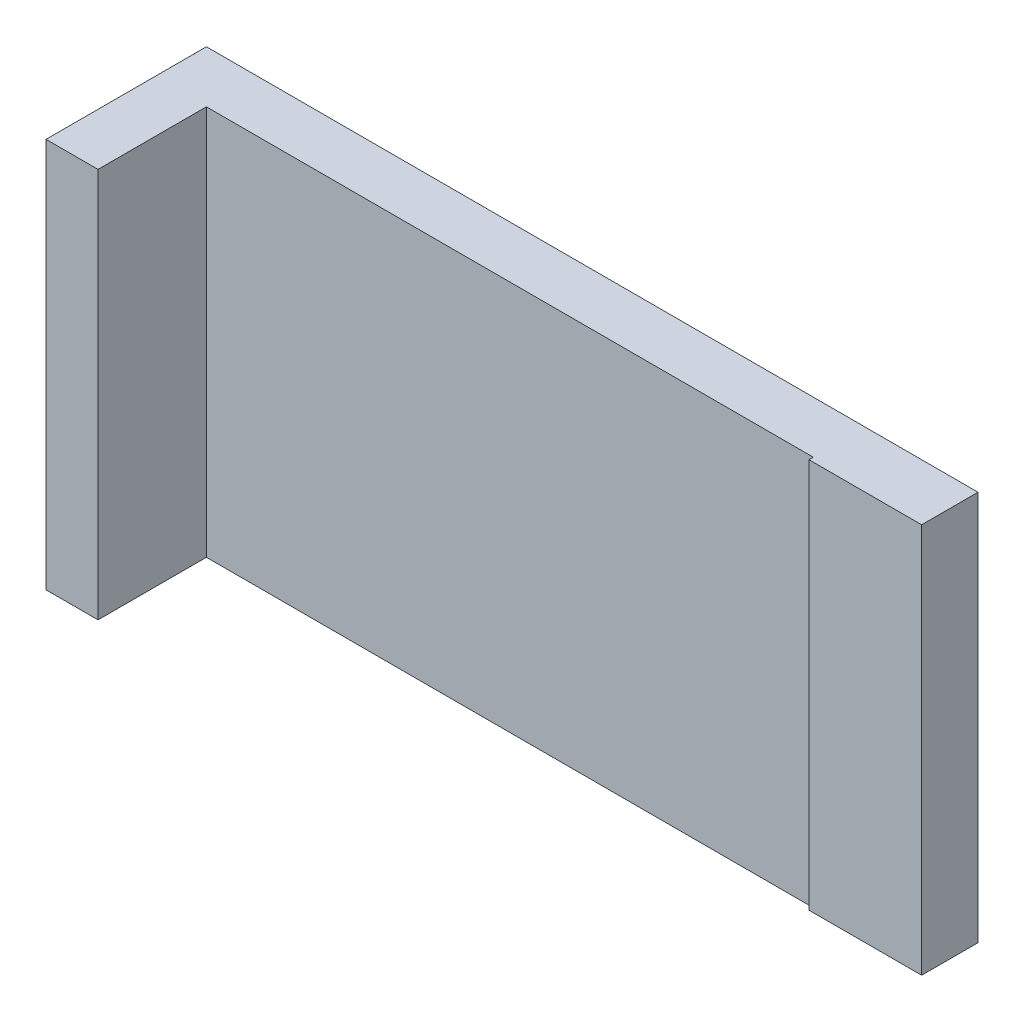
from build123d import *

# Parameters (mm, degrees)
ESBO_O1_W                = 41.5
ESBO_O1_H                = 22.5
RESSALTO_EXTRUS_O1_DEPTH = 3
ESBO_O2_W                = 9.25
ESBO_O2_H                = 22.5
RESSALTO_EXTRUS_O2_DEPTH = 3
ESBO_O3_W                = 6.5
ESBO_O3_H                = 22.5
RESSALTO_EXTRUS_O3_DEPTH = 3.25


with BuildPart() as part:
    # Esboço1 → Ressalto-extrusão1 (new body)
    with BuildSketch(Plane.XY):
        with Locations((4.5, 0)):
            Rectangle(ESBO_O1_W, ESBO_O1_H)
    extrude(amount=-RESSALTO_EXTRUS_O1_DEPTH)

    # Esboço2 → Ressalto-extrusão2 (add)
    with BuildSketch(Plane.ZY.offset(16.25)):
        with Locations((1.625, 0)):
            Rectangle(ESBO_O2_W, ESBO_O2_H)
    extrude(amount=RESSALTO_EXTRUS_O2_DEPTH)

    # Esboço3 → Ressalto-extrusão3 (add)
    with BuildSketch(Plane.XY.offset(-3)):
        with Locations((22, 0)):
            Rectangle(ESBO_O3_W, ESBO_O3_H)
    extrude(amount=RESSALTO_EXTRUS_O3_DEPTH)


solid = part.part
